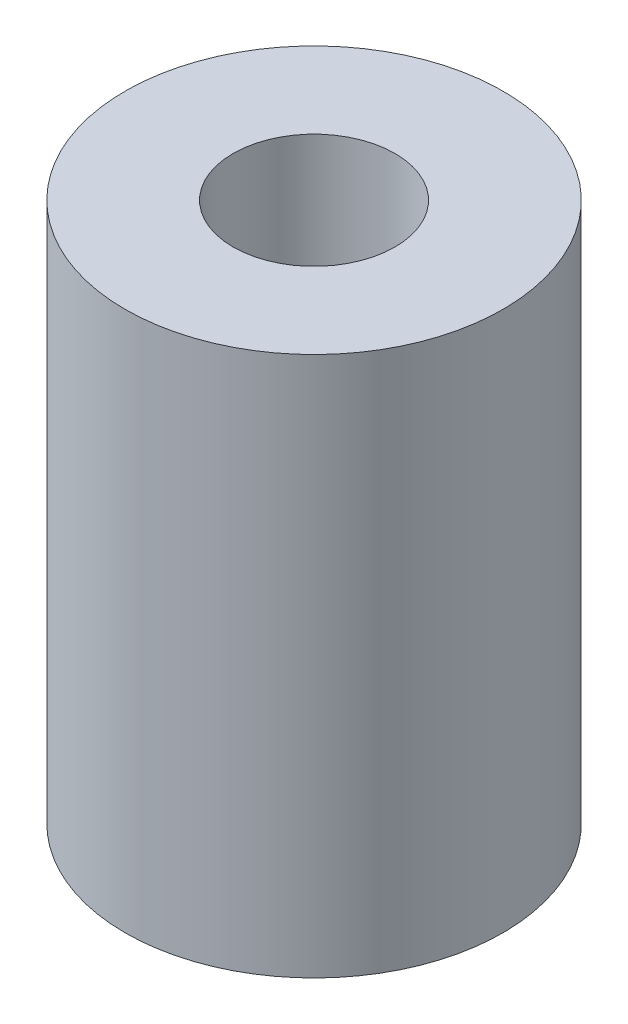
from build123d import *

# Parameters (mm, degrees)
SKETCH_1_R      = 3.5
SKETCH_1_R_2    = 1.5
EXTRUDE_1_DEPTH = 10


with BuildPart() as part:
    # 草图1 → 凸台-拉伸1 (new body)
    with BuildSketch(Plane(origin=(0, 0, 0), x_dir=(1, 0, 0), z_dir=(0, 1, 0))):
        with Locations(Location((0, 0, 0), (0, 0, 270))):
            Circle(SKETCH_1_R)
        with Locations(Location((0, 0, 0), (0, 0, 270))):
            Circle(SKETCH_1_R_2, mode=Mode.SUBTRACT)
    extrude(amount=EXTRUDE_1_DEPTH)


solid = part.part
